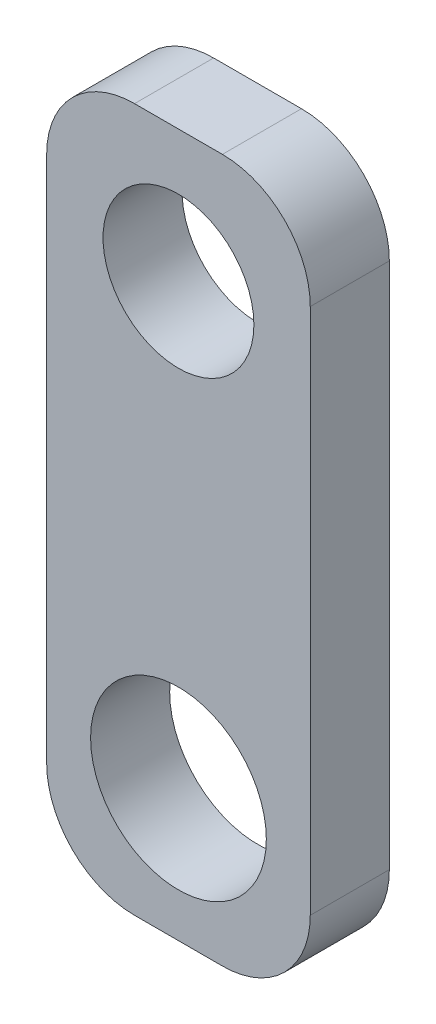
from build123d import *

# Parameters (mm, degrees)
SKETCH1_R           = 10.90295
SKETCH1_R_2         = 12.7
BOSS_EXTRUDE1_DEPTH = 11.43


with BuildPart() as part:
    # Sketch1 → Boss-Extrude1 (new body)
    with BuildSketch(Plane.XY):
        with BuildLine():
            Line((12.7, 0), (25.4, 0))
            ThreePointArc((25.4, 0), (34.380256121, 3.719743879), (38.1, 12.7))
            Line((38.1, 12.7), (38.1, 88.9))
            ThreePointArc((38.1, 88.9), (34.380256121, 97.880256121), (25.4, 101.6))
            Line((25.4, 101.6), (12.7, 101.6))
            ThreePointArc((12.7, 101.6), (3.719743879, 97.880256121), (0, 88.9))
            Line((0, 88.9), (0, 12.7))
            ThreePointArc((0, 12.7), (3.719743879, 3.719743879), (12.7, 0))
        make_face()
        with Locations((19.05, 82.55)):
            Circle(SKETCH1_R, mode=Mode.SUBTRACT)
        with Locations((19.05, 19.05)):
            Circle(SKETCH1_R_2, mode=Mode.SUBTRACT)
    extrude(amount=BOSS_EXTRUDE1_DEPTH)


solid = part.part
